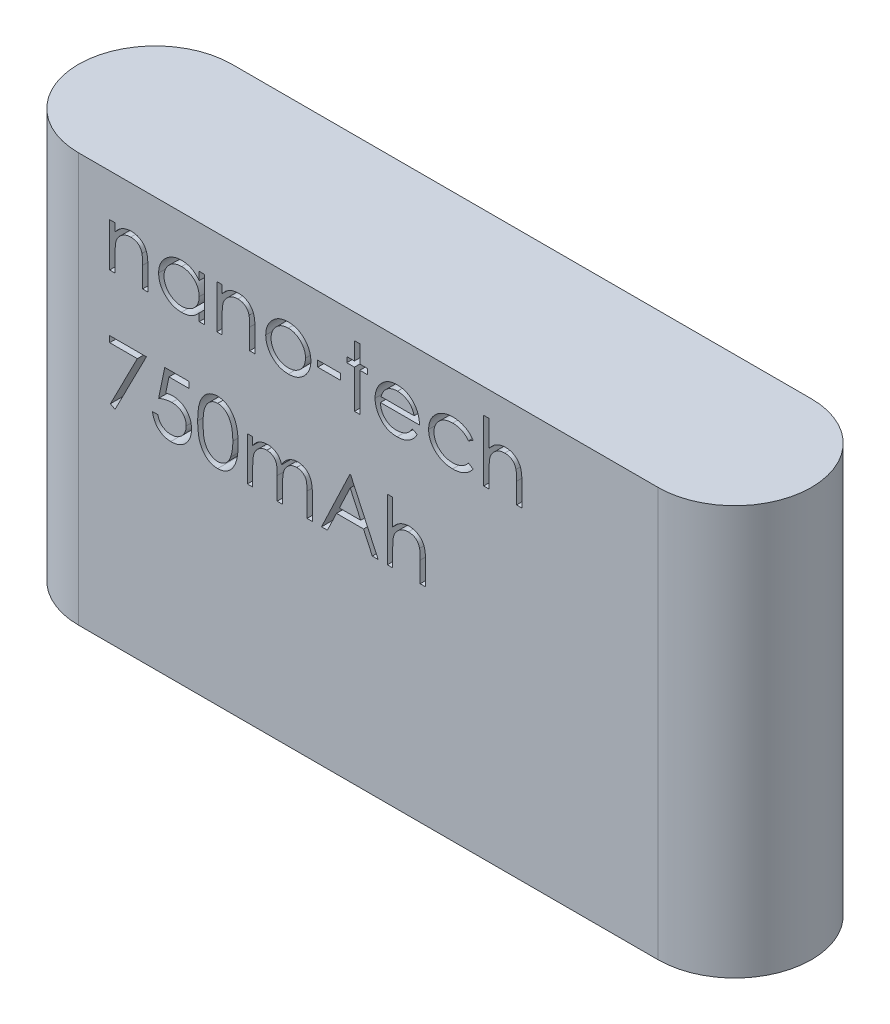
from build123d import *

# Parameters (mm, degrees)
SKICA1_W                 = 43
SKICA1_H                 = 24
P_IDAT_VYSUNUT_M1_DEPTH  = 9
ZAOBLIT1_RADIUS          = 4.5
ZAOBLIT1_LENGTH          = 24
ZAOBLIT2_RADIUS          = 4.5
ZAOBLIT2_LENGTH          = 24
SKICA2_W                 = 1.346153846
SKICA2_H                 = 0.358974359
ODEBRAT_VYSUNUT_M1_DEPTH = 6


with BuildPart() as part:
    # Skica1 → Přidat vysunutím1 (new body)
    with BuildSketch(Plane.XY):
        with Locations((-21.5, 12)):
            Rectangle(SKICA1_W, SKICA1_H)
    extrude(amount=P_IDAT_VYSUNUT_M1_DEPTH)

    # Zaoblit1: full round fillet: the end face becomes a half cylinder, R = half its width
    zaoblit1_face = Plane((-43, 12, 4.5), x_dir=(0, 1, 0), z_dir=(-1, 0, 0))  # on the end face: x along it, z out of the body
    zaoblit1_slab = zaoblit1_face.offset(-ZAOBLIT1_RADIUS / 2) * Box(ZAOBLIT1_LENGTH, 2 * ZAOBLIT1_RADIUS, ZAOBLIT1_RADIUS, mode=Mode.PRIVATE)  # the body's end, R deep
    zaoblit1_round = Plane((-38.5, 12, 4.5), x_dir=(-1, 0, 0), z_dir=(0, 1, 0)) * Cylinder(ZAOBLIT1_RADIUS, ZAOBLIT1_LENGTH, mode=Mode.PRIVATE)  # its axis R under the face
    add(zaoblit1_slab - zaoblit1_round, mode=Mode.SUBTRACT)

    # Zaoblit2: full round fillet: the end face becomes a half cylinder, R = half its width
    zaoblit2_face = Plane((0, 12, 4.5), x_dir=(0, -1, 0), z_dir=(1, 0, 0))  # on the end face: x along it, z out of the body
    zaoblit2_slab = zaoblit2_face.offset(-ZAOBLIT2_RADIUS / 2) * Box(ZAOBLIT2_LENGTH, 2 * ZAOBLIT2_RADIUS, ZAOBLIT2_RADIUS, mode=Mode.PRIVATE)  # the body's end, R deep
    zaoblit2_round = Plane((-4.5, 12, 4.5), x_dir=(1, 0, 0), z_dir=(0, -1, 0)) * Cylinder(ZAOBLIT2_RADIUS, ZAOBLIT2_LENGTH, mode=Mode.PRIVATE)  # its axis R under the face
    add(zaoblit2_slab - zaoblit2_round, mode=Mode.SUBTRACT)

    # Skica2 → Odebrat vysunutím1 (cut)
    # profile 1 of 15: a face of its own
    with BuildSketch(Plane.XY.offset(9)):
        with BuildLine():
            Line((-36.671617901, 21.517031429), (-36.357515337, 21.517031429))
            Line((-36.357515337, 21.517031429), (-36.357515337, 21.055693288))
            add(Edge.make_bspline(
                [(-36.357515337, 21.055693288), (-36.323977702, 21.097536011), (-36.258896751, 21.178733275), (-36.150512417, 21.285453849), (-36.035968517, 21.373399074), (-35.915966513, 21.443502868), (-35.790343503, 21.496349494), (-35.659865233, 21.534515425), (-35.523750527, 21.557400254), (-35.43118609, 21.560390484), (-35.384358285, 21.561903224)],
                knots=[0, 0, 0, 0, 1.12780773, 2.188550248, 3.19190651, 4.159438251, 5.104880172, 6.052711206, 7.014878035, 8, 8, 8, 8], degree=3))
            add(Edge.make_bspline(
                [(-35.384358285, 21.561903224), (-35.337027651, 21.560158029), (-35.244390184, 21.55674226), (-35.109512122, 21.529725569), (-34.983538728, 21.483580314), (-34.866919173, 21.420368244), (-34.761791959, 21.34176177), (-34.669467108, 21.250183989), (-34.59310386, 21.144847905), (-34.541906497, 21.047124749), (-34.50818085, 20.960435955), (-34.486948512, 20.886189205), (-34.468917531, 20.803471054), (-34.453285783, 20.712531465), (-34.442708671, 20.612733274), (-34.434366379, 20.504485582), (-34.428387685, 20.387823452), (-34.428150478, 20.307136824), (-34.428028157, 20.265529026)],
                knots=[0, 0, 0, 0, 1.235846778, 2.418850247, 3.575807741, 4.728682307, 5.871620074, 6.994088408, 8.11269785, 9.256955736, 9.865816715, 10.540099792, 11.271859618, 12.076849838, 12.949306005, 13.892391288, 14.913166135, 16, 16, 16, 16], degree=3))
            Line((-34.428028157, 20.265529026), (-34.428028157, 18.959339122))
            Line((-34.428028157, 18.959339122), (-34.742130721, 18.959339122))
            Line((-34.742130721, 18.959339122), (-34.742130721, 20.162464122))
            add(Edge.make_bspline(
                [(-34.742130721, 20.162464122), (-34.742323929, 20.197286567), (-34.742693503, 20.263895977), (-34.74385915, 20.359265001), (-34.746668957, 20.445751579), (-34.75061727, 20.523148946), (-34.7563963, 20.591382783), (-34.762418931, 20.65059206), (-34.769783908, 20.700701602), (-34.776346821, 20.730866685), (-34.779290176, 20.744395211)],
                knots=[0, 0, 0, 0, 1.430800155, 2.736877192, 3.918605307, 4.986035426, 5.920637409, 6.731861385, 7.431261377, 8, 8, 8, 8], degree=3))
            add(Edge.make_bspline(
                [(-34.779290176, 20.744395211), (-34.789915708, 20.784106396), (-34.810366569, 20.860538141), (-34.860900552, 20.964212494), (-34.924714733, 21.052410681), (-35.002612582, 21.124587403), (-35.093841658, 21.18075824), (-35.1981488, 21.219732195), (-35.314527441, 21.244108464), (-35.396381824, 21.246535596), (-35.439045785, 21.24780066)],
                knots=[0, 0, 0, 0, 1.084156227, 2.086665306, 3.027808233, 3.945421172, 4.874247719, 5.839848303, 6.874090471, 8, 8, 8, 8], degree=3))
            add(Edge.make_bspline(
                [(-35.439045785, 21.24780066), (-35.464313469, 21.247324656), (-35.514317562, 21.246382655), (-35.588467534, 21.236931357), (-35.660391707, 21.221472901), (-35.730811916, 21.200604263), (-35.79831971, 21.171941994), (-35.865084001, 21.139412624), (-35.928590765, 21.098864412), (-35.990194162, 21.053673791), (-36.04750697, 21.003594583), (-36.100835308, 20.950750073), (-36.148373329, 20.894474469), (-36.191442004, 20.835674522), (-36.228620267, 20.773542684), (-36.261073355, 20.708678377), (-36.28860905, 20.640996229), (-36.302291743, 20.594021167), (-36.309137933, 20.570517006)],
                knots=[0, 0, 0, 0, 1.023777757, 2.026029729, 3.023749952, 4.003683103, 4.997618607, 5.993177895, 7.010360494, 8.046726602, 9.087585522, 10.09234134, 11.086953743, 12.070360549, 13.043493632, 14.017870808, 15.008233677, 16, 16, 16, 16], degree=3))
            add(Edge.make_bspline(
                [(-36.309137933, 20.570517006), (-36.313077581, 20.553261803), (-36.32165399, 20.515698129), (-36.33091717, 20.454053709), (-36.339324746, 20.382743734), (-36.346361704, 20.301851417), (-36.350667121, 20.211093542), (-36.355361517, 20.110857705), (-36.357070578, 20.000744216), (-36.357362933, 19.924082523), (-36.357515337, 19.884118769)],
                knots=[0, 0, 0, 0, 0.615963638, 1.340920617, 2.168419149, 3.115676021, 4.16674242, 5.331190069, 6.6087489, 8, 8, 8, 8], degree=3))
            Line((-36.357515337, 19.884118769), (-36.357515337, 18.959339122))
            Line((-36.357515337, 18.959339122), (-36.671617901, 18.959339122))
            Line((-36.671617901, 18.959339122), (-36.671617901, 21.517031429))
        make_face()
    # profile 2 of 15: a face of its own
    with BuildSketch(Plane.XY.offset(9)):
        with BuildLine():
            Line((-31.107515337, 21.517031429), (-31.107515337, 18.959339122))
            Line((-31.107515337, 18.959339122), (-31.421617901, 18.959339122))
            Line((-31.421617901, 18.959339122), (-31.421617901, 19.401746974))
            add(Edge.make_bspline(
                [(-31.421617901, 19.401746974), (-31.457036691, 19.36170738), (-31.526156907, 19.283569609), (-31.641598025, 19.181487437), (-31.763966203, 19.097109115), (-31.892667524, 19.0289592), (-32.027585767, 18.977767143), (-32.168421854, 18.941380984), (-32.315233235, 18.917987149), (-32.41548559, 18.915651127), (-32.466289375, 18.914467327)],
                knots=[0, 0, 0, 0, 1.074387032, 2.096679803, 3.090159297, 4.057316773, 5.018401886, 5.985159533, 6.978961417, 8, 8, 8, 8], degree=3))
            add(Edge.make_bspline(
                [(-32.466289375, 18.914467327), (-32.511457329, 18.915693699), (-32.600530534, 18.91811216), (-32.731559611, 18.936874463), (-32.85765186, 18.967005085), (-32.978926433, 19.008905974), (-33.094598579, 19.064486796), (-33.205658675, 19.131028044), (-33.311531367, 19.210268874), (-33.410602906, 19.300856902), (-33.501834907, 19.39925189), (-33.581896179, 19.504197436), (-33.648649259, 19.61523974), (-33.70446934, 19.730972894), (-33.747465684, 19.852287814), (-33.777439318, 19.978764982), (-33.796179765, 20.110254855), (-33.798597226, 20.199794378), (-33.799823029, 20.245196494)],
                knots=[0, 0, 0, 0, 1.033919861, 2.038935746, 3.024066025, 3.998881131, 4.97069526, 5.957263378, 6.95902576, 7.993208707, 9.027059324, 10.027763471, 11.009749337, 11.988697705, 12.965288445, 13.950418724, 14.960734635, 16, 16, 16, 16], degree=3))
            add(Edge.make_bspline(
                [(-33.799823029, 20.245196494), (-33.798570058, 20.289660197), (-33.796093001, 20.37756254), (-33.777639781, 20.506841238), (-33.746608772, 20.631359499), (-33.703060925, 20.750716442), (-33.64721897, 20.865056492), (-33.579290883, 20.974460518), (-33.499271758, 21.079229915), (-33.407019351, 21.176901142), (-33.307084581, 21.267121756), (-33.20017585, 21.345530801), (-33.088952569, 21.41324765), (-32.971689558, 21.466901127), (-32.850122453, 21.510310231), (-32.723169007, 21.540343199), (-32.591357429, 21.558040521), (-32.501866937, 21.560603285), (-32.45647367, 21.561903224)],
                knots=[0, 0, 0, 0, 1.020392517, 2.01726096, 2.990465484, 3.961182959, 4.928053699, 5.906110375, 6.912531644, 7.948652711, 8.985773172, 9.998621852, 10.987621588, 11.969261332, 12.953316658, 13.946091881, 14.958173133, 16, 16, 16, 16], degree=3))
            add(Edge.make_bspline(
                [(-32.45647367, 21.561903224), (-32.404273811, 21.560465473), (-32.301912351, 21.55764611), (-32.152184342, 21.534183383), (-32.010539864, 21.494544915), (-31.875885512, 21.440627417), (-31.748704826, 21.368978688), (-31.630201841, 21.278598727), (-31.519136358, 21.17005754), (-31.454756066, 21.086687096), (-31.421617901, 21.043774218)],
                knots=[0, 0, 0, 0, 1.038897134, 2.037228247, 3.008116434, 3.962042015, 4.918381754, 5.904844433, 6.921570401, 8, 8, 8, 8], degree=3))
            Line((-31.421617901, 21.043774218), (-31.421617901, 21.517031429))
            Line((-31.421617901, 21.517031429), (-31.107515337, 21.517031429))
        make_face()
        with BuildLine():
            add(Edge.make_bspline(
                [(-32.452266939, 21.24780066), (-32.498181277, 21.246167022), (-32.588808877, 21.242942481), (-32.721852879, 21.217768986), (-32.849166293, 21.175884392), (-32.970112368, 21.118602491), (-33.082780584, 21.046573754), (-33.183474255, 20.959452371), (-33.273016956, 20.859615357), (-33.348325221, 20.747513246), (-33.409715717, 20.627335155), (-33.452882749, 20.501710717), (-33.481351997, 20.37290574), (-33.484260517, 20.285543054), (-33.485720465, 20.241690885)],
                knots=[0, 0, 0, 0, 1.031046209, 2.035121221, 3.029706178, 4.034933723, 5.034054252, 6.02443088, 7.017295772, 8.038157696, 9.050218397, 10.03989886, 11.016116709, 12, 12, 12, 12], degree=3))
            add(Edge.make_bspline(
                [(-33.485720465, 20.241690885), (-33.483855572, 20.198100777), (-33.480133095, 20.111091421), (-33.4533824, 19.982110845), (-33.408502527, 19.856456803), (-33.347260464, 19.735195809), (-33.270573839, 19.622611709), (-33.181685187, 19.520871586), (-33.079734906, 19.433381998), (-32.966807399, 19.360144424), (-32.846199428, 19.300981903), (-32.719365497, 19.259816264), (-32.588689858, 19.233238483), (-32.499837525, 19.230134006), (-32.455071426, 19.228569891)],
                knots=[0, 0, 0, 0, 0.979072187, 1.954306742, 2.945804271, 3.96968567, 4.997920485, 5.998718438, 6.996577872, 8.005894225, 9.015743152, 10.005417472, 10.995077863, 12, 12, 12, 12], degree=3))
            add(Edge.make_bspline(
                [(-32.455071426, 19.228569891), (-32.409624924, 19.230229855), (-32.319236337, 19.233531358), (-32.185797629, 19.258812624), (-32.056302666, 19.300581422), (-31.932515438, 19.358480549), (-31.817199307, 19.430237905), (-31.713701429, 19.514244996), (-31.626185461, 19.61194818), (-31.551992851, 19.719324633), (-31.493817435, 19.837036629), (-31.451441375, 19.96237082), (-31.42638747, 20.095331568), (-31.42322974, 20.186195495), (-31.421617901, 20.232576301)],
                knots=[0, 0, 0, 0, 1.01762866, 2.023962475, 3.030623092, 4.058876274, 5.077231937, 6.066672613, 7.034107872, 8.005628644, 8.981990164, 9.965428785, 10.961468474, 12, 12, 12, 12], degree=3))
            add(Edge.make_bspline(
                [(-31.421617901, 20.232576301), (-31.422577557, 20.267914132), (-31.424466465, 20.337470165), (-31.438897034, 20.439597683), (-31.461851961, 20.537331409), (-31.494198131, 20.630774098), (-31.536689415, 20.719409113), (-31.587937181, 20.803872873), (-31.648842631, 20.883726085), (-31.718425327, 20.957869156), (-31.794590529, 21.025495618), (-31.87518507, 21.085859859), (-31.961163817, 21.135448631), (-32.051080854, 21.176489903), (-32.145092188, 21.209149053), (-32.243962808, 21.230936747), (-32.346641795, 21.245897068), (-32.41668785, 21.247159448), (-32.452266939, 21.24780066)],
                knots=[0, 0, 0, 0, 1.050140795, 2.067009409, 3.05949893, 4.030605086, 5.00011959, 5.97591094, 6.962425594, 7.979863591, 8.993523472, 9.986985069, 10.967611495, 11.937549037, 12.921786183, 13.919465291, 14.943216303, 16, 16, 16, 16], degree=3))
        make_face(mode=Mode.SUBTRACT)
    # profile 3 of 15: a face of its own
    with BuildSketch(Plane.XY.offset(9)):
        with BuildLine():
            Line((-30.389566619, 21.517031429), (-30.075464055, 21.517031429))
            Line((-30.075464055, 21.517031429), (-30.075464055, 21.055693288))
            add(Edge.make_bspline(
                [(-30.075464055, 21.055693288), (-30.04192642, 21.097536011), (-29.976845468, 21.178733275), (-29.868461135, 21.285453849), (-29.753917235, 21.373399074), (-29.633915231, 21.443502868), (-29.508292221, 21.496349494), (-29.377813951, 21.534515425), (-29.241699245, 21.557400254), (-29.149134808, 21.560390484), (-29.102307003, 21.561903224)],
                knots=[0, 0, 0, 0, 1.12780773, 2.188550248, 3.19190651, 4.159438251, 5.104880172, 6.052711206, 7.014878035, 8, 8, 8, 8], degree=3))
            add(Edge.make_bspline(
                [(-29.102307003, 21.561903224), (-29.054976369, 21.560158029), (-28.962338901, 21.55674226), (-28.82746084, 21.529725569), (-28.701487446, 21.483580314), (-28.584867891, 21.420368244), (-28.479740677, 21.34176177), (-28.387415826, 21.250183989), (-28.311052578, 21.144847905), (-28.259855215, 21.047124749), (-28.226129568, 20.960435955), (-28.20489723, 20.886189205), (-28.186866249, 20.803471054), (-28.171234501, 20.712531465), (-28.160657389, 20.612733274), (-28.152315097, 20.504485582), (-28.146336403, 20.387823452), (-28.146099196, 20.307136824), (-28.145976875, 20.265529026)],
                knots=[0, 0, 0, 0, 1.235846778, 2.418850247, 3.575807741, 4.728682307, 5.871620074, 6.994088408, 8.11269785, 9.256955736, 9.865816715, 10.540099792, 11.271859618, 12.076849838, 12.949306005, 13.892391288, 14.913166135, 16, 16, 16, 16], degree=3))
            Line((-28.145976875, 20.265529026), (-28.145976875, 18.959339122))
            Line((-28.145976875, 18.959339122), (-28.460079439, 18.959339122))
            Line((-28.460079439, 18.959339122), (-28.460079439, 20.162464122))
            add(Edge.make_bspline(
                [(-28.460079439, 20.162464122), (-28.460272647, 20.197286567), (-28.460642221, 20.263895977), (-28.461807868, 20.359265001), (-28.464617675, 20.445751579), (-28.468565988, 20.523148946), (-28.474345018, 20.591382783), (-28.480367649, 20.65059206), (-28.487732626, 20.700701602), (-28.494295539, 20.730866685), (-28.497238894, 20.744395211)],
                knots=[0, 0, 0, 0, 1.430800155, 2.736877192, 3.918605307, 4.986035426, 5.920637409, 6.731861385, 7.431261377, 8, 8, 8, 8], degree=3))
            add(Edge.make_bspline(
                [(-28.497238894, 20.744395211), (-28.507864426, 20.784106396), (-28.528315287, 20.860538141), (-28.57884927, 20.964212494), (-28.64266345, 21.052410681), (-28.7205613, 21.124587403), (-28.811790375, 21.18075824), (-28.916097518, 21.219732195), (-29.032476159, 21.244108464), (-29.114330542, 21.246535596), (-29.156994503, 21.24780066)],
                knots=[0, 0, 0, 0, 1.084156227, 2.086665306, 3.027808233, 3.945421172, 4.874247719, 5.839848303, 6.874090471, 8, 8, 8, 8], degree=3))
            add(Edge.make_bspline(
                [(-29.156994503, 21.24780066), (-29.182262187, 21.247324656), (-29.23226628, 21.246382655), (-29.306416252, 21.236931357), (-29.378340425, 21.221472901), (-29.448760634, 21.200604263), (-29.516268428, 21.171941994), (-29.583032719, 21.139412624), (-29.646539483, 21.098864412), (-29.70814288, 21.053673791), (-29.765455688, 21.003594583), (-29.818784026, 20.950750073), (-29.866322047, 20.894474469), (-29.909390722, 20.835674522), (-29.946568985, 20.773542684), (-29.979022073, 20.708678377), (-30.006557768, 20.640996229), (-30.020240461, 20.594021167), (-30.027086651, 20.570517006)],
                knots=[0, 0, 0, 0, 1.023777757, 2.026029729, 3.023749952, 4.003683103, 4.997618607, 5.993177895, 7.010360494, 8.046726602, 9.087585522, 10.09234134, 11.086953743, 12.070360549, 13.043493632, 14.017870808, 15.008233677, 16, 16, 16, 16], degree=3))
            add(Edge.make_bspline(
                [(-30.027086651, 20.570517006), (-30.031026299, 20.553261803), (-30.039602708, 20.515698129), (-30.048865888, 20.454053709), (-30.057273464, 20.382743734), (-30.064310422, 20.301851417), (-30.068615839, 20.211093542), (-30.073310235, 20.110857705), (-30.075019296, 20.000744216), (-30.07531165, 19.924082523), (-30.075464055, 19.884118769)],
                knots=[0, 0, 0, 0, 0.615963638, 1.340920617, 2.168419149, 3.115676021, 4.16674242, 5.331190069, 6.6087489, 8, 8, 8, 8], degree=3))
            Line((-30.075464055, 19.884118769), (-30.075464055, 18.959339122))
            Line((-30.075464055, 18.959339122), (-30.389566619, 18.959339122))
            Line((-30.389566619, 18.959339122), (-30.389566619, 21.517031429))
        make_face()
    # profile 4 of 15: a face of its own
    with BuildSketch(Plane.XY.offset(9)):
        with BuildLine():
            add(Edge.make_bspline(
                [(-26.192651555, 21.561903224), (-26.144660282, 21.560881333), (-26.050561124, 21.558877654), (-25.912753238, 21.537462689), (-25.781208102, 21.504715324), (-25.65542191, 21.459443762), (-25.537005615, 21.398761812), (-25.424234371, 21.326352521), (-25.317417362, 21.240569927), (-25.253394333, 21.174211859), (-25.220896747, 21.140529026)],
                knots=[0, 0, 0, 0, 1.054011418, 2.066658804, 3.057071809, 4.030435133, 4.997543892, 5.974964718, 6.972108034, 8, 8, 8, 8], degree=3))
            add(Edge.make_bspline(
                [(-25.220896747, 21.140529026), (-25.192914793, 21.10831504), (-25.137492413, 21.044510498), (-25.066426694, 20.941054885), (-25.005205134, 20.833914784), (-24.956142173, 20.721667457), (-24.917457149, 20.605292786), (-24.889991453, 20.484390775), (-24.873654518, 20.359228428), (-24.871451551, 20.27422459), (-24.87033585, 20.231174058)],
                knots=[0, 0, 0, 0, 1.025258237, 2.030674902, 3.01204498, 3.988269485, 4.97094183, 5.956517959, 6.965070386, 8, 8, 8, 8], degree=3))
            add(Edge.make_bspline(
                [(-24.87033585, 20.231174058), (-24.871317187, 20.187874), (-24.873256355, 20.102311067), (-24.891599972, 19.976291701), (-24.920131057, 19.854096878), (-24.960962896, 19.736238184), (-25.013321005, 19.622355357), (-25.077211692, 19.512945808), (-25.15308331, 19.407793674), (-25.239087306, 19.307791836), (-25.334139182, 19.215625621), (-25.437255331, 19.135297352), (-25.546409365, 19.066475827), (-25.663052718, 19.011039412), (-25.786120205, 18.967329712), (-25.915877273, 18.936629695), (-26.052122343, 18.918068011), (-26.145149564, 18.915684438), (-26.192651555, 18.914467327)],
                knots=[0, 0, 0, 0, 0.998656419, 1.973391657, 2.932242238, 3.890759089, 4.846373663, 5.82037756, 6.809684879, 7.83454468, 8.860553229, 9.859544525, 10.845671541, 11.83227036, 12.833544569, 13.85385346, 14.904124723, 16, 16, 16, 16], degree=3))
            add(Edge.make_bspline(
                [(-26.192651555, 18.914467327), (-26.240386274, 18.915688523), (-26.333877134, 18.918080298), (-26.470603116, 18.93655758), (-26.600592735, 18.967315563), (-26.723821333, 19.011183056), (-26.84096618, 19.066477599), (-26.950752677, 19.135089289), (-27.053952593, 19.215649444), (-27.149024577, 19.307785381), (-27.235023182, 19.407795338), (-27.310896191, 19.512945376), (-27.374786517, 19.622355469), (-27.427144721, 19.736238154), (-27.467976534, 19.854096886), (-27.496507626, 19.976291699), (-27.514851241, 20.102311067), (-27.51679041, 20.187874), (-27.517771747, 20.231174058)],
                knots=[0, 0, 0, 0, 1.099876186, 2.154163076, 3.173186993, 4.173200201, 5.163417411, 6.152872554, 7.150605724, 8.17532212, 9.198891216, 10.186952605, 11.159729845, 12.11414092, 13.071450619, 14.029093627, 15.002601286, 16, 16, 16, 16], degree=3))
            add(Edge.make_bspline(
                [(-27.517771747, 20.231174058), (-27.516648437, 20.273990604), (-27.514424475, 20.358760006), (-27.498103966, 20.483687067), (-27.47074541, 20.604384456), (-27.432014013, 20.720309932), (-27.382498822, 20.832065368), (-27.322137534, 20.939470199), (-27.250346902, 21.042457999), (-27.19514495, 21.106180079), (-27.16721085, 21.13842566)],
                knots=[0, 0, 0, 0, 1.031353054, 2.041901799, 3.029428768, 4.008703097, 4.981709435, 5.96992636, 6.972712378, 8, 8, 8, 8], degree=3))
            add(Edge.make_bspline(
                [(-27.16721085, 21.13842566), (-27.134762258, 21.172400599), (-27.070946395, 21.239218296), (-26.963597667, 21.32475082), (-26.851103846, 21.398666894), (-26.73137892, 21.458143109), (-26.605696062, 21.504981627), (-26.473476819, 21.537547142), (-26.335201304, 21.558800497), (-26.240641683, 21.560858675), (-26.192651555, 21.561903224)],
                knots=[0, 0, 0, 0, 1.027980169, 2.021703884, 2.998553061, 3.971491411, 4.943284454, 5.930300938, 6.949603206, 8, 8, 8, 8], degree=3))
        make_face()
        with BuildLine():
            add(Edge.make_bspline(
                [(-26.194053798, 21.24780066), (-26.22799141, 21.246836069), (-26.294990538, 21.244931786), (-26.393610123, 21.230447881), (-26.488550277, 21.207500377), (-26.579991121, 21.174896321), (-26.667624293, 21.132797422), (-26.751533696, 21.081089062), (-26.831966136, 21.020456105), (-26.907348199, 20.950993434), (-26.976530511, 20.875114439), (-27.037008488, 20.79426608), (-27.088433594, 20.709759734), (-27.131273753, 20.621507523), (-27.163180941, 20.528615109), (-27.186353964, 20.432134478), (-27.200824204, 20.331869061), (-27.202710583, 20.263708043), (-27.203669183, 20.229070692)],
                knots=[0, 0, 0, 0, 1.021534396, 2.016698045, 2.994645724, 3.958388632, 4.93408049, 5.916473867, 6.921342795, 7.962252576, 8.998418191, 10.008913653, 10.997312074, 11.973003931, 12.956656626, 13.948281152, 14.957379055, 16, 16, 16, 16], degree=3))
            add(Edge.make_bspline(
                [(-27.203669183, 20.229070692), (-27.202062359, 20.184318665), (-27.198873115, 20.09549426), (-27.172937878, 19.964683137), (-27.129551598, 19.839101285), (-27.070964319, 19.719484899), (-26.9975581, 19.608812621), (-26.911071033, 19.510141136), (-26.812431333, 19.424955325), (-26.702814833, 19.354274479), (-26.584460515, 19.298114724), (-26.459204194, 19.258315748), (-26.3285635, 19.232444056), (-26.239282769, 19.229872581), (-26.194053798, 19.228569891)],
                knots=[0, 0, 0, 0, 1.016792936, 2.018143844, 3.017858371, 4.030088057, 5.03801393, 6.028138512, 7.003788237, 7.991172063, 8.984598303, 9.972568034, 10.972917682, 12, 12, 12, 12], degree=3))
            add(Edge.make_bspline(
                [(-26.194053798, 19.228569891), (-26.148827429, 19.229880171), (-26.059551833, 19.232466628), (-25.929092657, 19.258185448), (-25.804178685, 19.298289108), (-25.685947297, 19.354211318), (-25.576380694, 19.425223733), (-25.477031572, 19.50966011), (-25.391282961, 19.609073962), (-25.317949356, 19.71963149), (-25.258402614, 19.838915842), (-25.215219412, 19.964706315), (-25.189221826, 20.095488357), (-25.186040997, 20.184316687), (-25.184438414, 20.229070692)],
                knots=[0, 0, 0, 0, 1.02726834, 2.027799167, 3.010890988, 4.004497153, 4.992059811, 5.971914811, 6.958719428, 7.966827853, 8.981595046, 9.981490638, 10.983022906, 12, 12, 12, 12], degree=3))
            add(Edge.make_bspline(
                [(-25.184438414, 20.229070692), (-25.185396684, 20.26370825), (-25.187282413, 20.331869676), (-25.201757377, 20.432132129), (-25.224912917, 20.528623726), (-25.256884534, 20.621475729), (-25.299538548, 20.709988233), (-25.351955341, 20.79401796), (-25.412186366, 20.875394507), (-25.482203487, 20.950748147), (-25.557506865, 21.020483184), (-25.637971903, 21.081112573), (-25.721756882, 21.132570169), (-25.809135465, 21.175256409), (-25.900588032, 21.20720375), (-25.995395161, 21.230580381), (-26.093593971, 21.244870578), (-26.160353015, 21.246817719), (-26.194053798, 21.24780066)],
                knots=[0, 0, 0, 0, 1.042956736, 2.052379634, 3.044323526, 4.02829302, 5.004299113, 5.996692471, 7.007513377, 8.048758398, 9.090003419, 10.095195979, 11.07790575, 12.047570684, 13.018257071, 13.989683339, 14.985167495, 16, 16, 16, 16], degree=3))
        make_face(mode=Mode.SUBTRACT)
    # profile 5 of 15: a face of its own
    with BuildSketch(Plane.XY.offset(9)):
        with Locations((-23.793412773, 20.305492968)):
            Rectangle(SKICA2_W, SKICA2_H)
    # profile 6 of 15: a face of its own
    with BuildSketch(Plane.XY.offset(9)):
        Polygon((-22.312643542, 22.549082711), (-21.998540978, 22.549082711), (-21.998540978, 21.517031429), (-21.549823029, 21.517031429), (-21.549823029, 21.202928865), (-21.998540978, 21.202928865), (-21.998540978, 18.959339122), (-22.312643542, 18.959339122), (-22.312643542, 21.202928865), (-22.761361491, 21.202928865), (-22.761361491, 21.517031429), (-22.312643542, 21.517031429), align=None)
    # profile 7 of 15: a face of its own
    with BuildSketch(Plane.XY.offset(9)):
        with BuildLine():
            Line((-18.912202837, 19.767031429), (-18.633156362, 19.620496974))
            add(Edge.make_bspline(
                [(-18.633156362, 19.620496974), (-18.655392958, 19.581053643), (-18.698656566, 19.50431254), (-18.773057314, 19.39888068), (-18.851049387, 19.304032964), (-18.936153355, 19.22230331), (-19.025823033, 19.151051925), (-19.120555688, 19.0887141), (-19.220844506, 19.03559558), (-19.326694231, 18.990843052), (-19.438993782, 18.956433558), (-19.558015298, 18.932129337), (-19.683986794, 18.917106068), (-19.770332974, 18.915360927), (-19.814546587, 18.914467327)],
                knots=[0, 0, 0, 0, 1.120438281, 2.179929193, 3.190490725, 4.156257408, 5.095198341, 6.022838206, 6.959905092, 7.901321166, 8.864066838, 9.862729781, 10.905609505, 12, 12, 12, 12], degree=3))
            add(Edge.make_bspline(
                [(-19.814546587, 18.914467327), (-19.863688564, 18.915614502), (-19.959550326, 18.917852309), (-20.099090073, 18.937144773), (-20.230469491, 18.968617132), (-20.353681195, 19.012582674), (-20.468423447, 19.070009998), (-20.574924302, 19.139969479), (-20.673743828, 19.222101734), (-20.761768037, 19.317118178), (-20.84101192, 19.418800135), (-20.91093774, 19.524756019), (-20.969395171, 19.634719244), (-21.016947781, 19.747989768), (-21.055352646, 19.863853661), (-21.08211935, 19.983365129), (-21.097549098, 20.106200713), (-21.099913543, 20.189298049), (-21.10110508, 20.231174058)],
                knots=[0, 0, 0, 0, 1.145258523, 2.234067595, 3.276747158, 4.290159414, 5.277019952, 6.260822364, 7.254936242, 8.264827045, 9.274100331, 10.257902744, 11.220704747, 12.172965371, 13.118907548, 14.062713208, 15.023725156, 16, 16, 16, 16], degree=3))
            add(Edge.make_bspline(
                [(-21.10110508, 20.231174058), (-21.100045939, 20.270468888), (-21.097946861, 20.348346053), (-21.084716073, 20.463611597), (-21.06126778, 20.57564005), (-21.029091456, 20.684524498), (-20.98754021, 20.790082632), (-20.936707991, 20.892378695), (-20.876515613, 20.991303835), (-20.830042939, 21.053706969), (-20.806633926, 21.085140404)],
                knots=[0, 0, 0, 0, 1.024358464, 2.0301432, 3.019427413, 4.004406732, 4.986367066, 5.972626655, 6.978780325, 8, 8, 8, 8], degree=3))
            add(Edge.make_bspline(
                [(-20.806633926, 21.085140404), (-20.774926244, 21.123009274), (-20.712515297, 21.197547424), (-20.606958942, 21.29548575), (-20.492658745, 21.377529525), (-20.371047119, 21.445536661), (-20.240710645, 21.497210308), (-20.103401354, 21.535717891), (-19.957555768, 21.557295902), (-19.857850547, 21.560343735), (-19.806834247, 21.561903224)],
                knots=[0, 0, 0, 0, 1.030682036, 2.02871468, 2.997146059, 3.962720338, 4.930598197, 5.918074684, 6.934738563, 8, 8, 8, 8], degree=3))
            add(Edge.make_bspline(
                [(-19.806834247, 21.561903224), (-19.754386642, 21.560549175), (-19.651496396, 21.55789284), (-19.501464275, 21.533266507), (-19.359503558, 21.494213952), (-19.225671054, 21.439060162), (-19.099953193, 21.36790061), (-18.983167144, 21.279758768), (-18.873315631, 21.177340681), (-18.809407052, 21.098577472), (-18.77688633, 21.058497776)],
                knots=[0, 0, 0, 0, 1.056321875, 2.072262726, 3.055038591, 4.01806755, 4.982017516, 5.957941055, 6.960871419, 8, 8, 8, 8], degree=3))
            add(Edge.make_bspline(
                [(-18.77688633, 21.058497776), (-18.754759392, 21.028294194), (-18.710652799, 20.968088075), (-18.655405699, 20.869916918), (-18.607448304, 20.767206324), (-18.569115343, 20.658296027), (-18.538075842, 20.544476447), (-18.515619023, 20.424933902), (-18.502449404, 20.299703991), (-18.499860707, 20.214377435), (-18.498540978, 20.170877583)],
                knots=[0, 0, 0, 0, 0.94817472, 1.890038105, 2.849395472, 3.817997239, 4.812318967, 5.836947057, 6.897266129, 8, 8, 8, 8], degree=3))
            Line((-18.498540978, 20.170877583), (-20.787002516, 20.170877583))
            add(Edge.make_bspline(
                [(-20.787002516, 20.170877583), (-20.78546291, 20.137177119), (-20.782435336, 20.070906515), (-20.768320193, 19.973935732), (-20.746071419, 19.88156239), (-20.714802356, 19.794479348), (-20.676935511, 19.711549221), (-20.630549794, 19.633387184), (-20.57521024, 19.560349254), (-20.513484541, 19.491782116), (-20.444777446, 19.430721355), (-20.372494698, 19.376069579), (-20.295601133, 19.330263982), (-20.21470305, 19.293084092), (-20.129931265, 19.263977776), (-20.04125907, 19.244109955), (-19.948860953, 19.230802848), (-19.885875219, 19.229323183), (-19.853809407, 19.228569891)],
                knots=[0, 0, 0, 0, 1.094153842, 2.151609401, 3.174256925, 4.172055639, 5.149267565, 6.128595816, 7.11444997, 8.118368179, 9.117203808, 10.09244225, 11.054858984, 12.015122123, 12.976791628, 13.957293641, 14.960065497, 16, 16, 16, 16], degree=3))
            add(Edge.make_bspline(
                [(-19.853809407, 19.228569891), (-19.82245826, 19.229177948), (-19.760251569, 19.230384449), (-19.667610711, 19.24211636), (-19.576471184, 19.261086635), (-19.487210201, 19.286976625), (-19.401639355, 19.318553477), (-19.322393805, 19.356656335), (-19.249513589, 19.398806082), (-19.181396622, 19.447015757), (-19.115325629, 19.506023944), (-19.049783143, 19.579659665), (-18.979506489, 19.666747193), (-18.935516897, 19.732292859), (-18.912202837, 19.767031429)],
                knots=[0, 0, 0, 0, 0.99110716, 1.966546729, 2.947904876, 3.932708344, 4.903319531, 5.828989031, 6.710028674, 7.56322171, 8.463672341, 9.504779593, 10.677557249, 12, 12, 12, 12], degree=3))
        make_face()
        with BuildLine():
            add(Edge.make_bspline(
                [(-18.812643542, 20.484980147), (-18.824140166, 20.526643021), (-18.846267468, 20.606830642), (-18.892503832, 20.717871532), (-18.944575373, 20.816559433), (-19.006197104, 20.902139066), (-19.07601583, 20.978142579), (-19.156661013, 21.044561164), (-19.247096906, 21.103978615), (-19.346856047, 21.154131115), (-19.452497832, 21.196820974), (-19.563104024, 21.225446089), (-19.675961812, 21.245055632), (-19.752296098, 21.24688174), (-19.790708446, 21.24780066)],
                knots=[0, 0, 0, 0, 1.154881502, 2.222775134, 3.210006277, 4.132804581, 5.035138423, 5.962687519, 6.919655026, 7.923214229, 8.944639381, 9.960483929, 10.97369054, 12, 12, 12, 12], degree=3))
            add(Edge.make_bspline(
                [(-19.790708446, 21.24780066), (-19.822057884, 21.247188989), (-19.884029133, 21.245979843), (-19.975330201, 21.234509713), (-20.0630099, 21.215549868), (-20.147715188, 21.189584912), (-20.228336056, 21.154976309), (-20.306530825, 21.114393083), (-20.380311221, 21.064851499), (-20.426452516, 21.027092644), (-20.449762933, 21.008017006)],
                knots=[0, 0, 0, 0, 1.04873581, 2.073130211, 3.073294108, 4.04793562, 5.032784715, 6.005352987, 6.992311501, 8, 8, 8, 8], degree=3))
            add(Edge.make_bspline(
                [(-20.449762933, 21.008017006), (-20.466456215, 20.992922691), (-20.500239349, 20.962375475), (-20.545379871, 20.909746268), (-20.588600343, 20.852994706), (-20.627933996, 20.789949581), (-20.664011582, 20.721328802), (-20.69777156, 20.647711167), (-20.728157972, 20.568538037), (-20.745254082, 20.513365598), (-20.754049792, 20.484980147)],
                knots=[0, 0, 0, 0, 0.879870761, 1.780643979, 2.707998968, 3.669668524, 4.684282772, 5.740141944, 6.837334558, 8, 8, 8, 8], degree=3))
            Line((-20.754049792, 20.484980147), (-18.812643542, 20.484980147))
        make_face(mode=Mode.SUBTRACT)
    # profile 8 of 15: a face of its own
    with BuildSketch(Plane.XY.offset(9)):
        with BuildLine():
            Line((-15.357515337, 20.96244409), (-15.62043601, 20.799082711))
            add(Edge.make_bspline(
                [(-15.62043601, 20.799082711), (-15.649265875, 20.834911105), (-15.70601257, 20.905433216), (-15.804551807, 20.996443149), (-15.909563221, 21.074610191), (-16.022841269, 21.138313942), (-16.144227069, 21.187535392), (-16.27324192, 21.222365597), (-16.409867425, 21.24406984), (-16.503532624, 21.246536677), (-16.551525753, 21.24780066)],
                knots=[0, 0, 0, 0, 1.026593902, 2.0206758, 2.988051866, 3.946915611, 4.916868779, 5.907761954, 6.927957743, 8, 8, 8, 8], degree=3))
            add(Edge.make_bspline(
                [(-16.551525753, 21.24780066), (-16.58988471, 21.246743818), (-16.665431633, 21.244662396), (-16.776337786, 21.231651903), (-16.881980139, 21.208009894), (-16.983020848, 21.176858938), (-17.078741267, 21.135108648), (-17.169392185, 21.084298892), (-17.255777675, 21.025248851), (-17.335394417, 20.956838306), (-17.408223424, 20.882439638), (-17.471322338, 20.802685943), (-17.526259271, 20.719966052), (-17.569365227, 20.632214309), (-17.604640398, 20.541438256), (-17.627847118, 20.4459244), (-17.643311813, 20.346896393), (-17.645081142, 20.279378053), (-17.645976875, 20.245196494)],
                knots=[0, 0, 0, 0, 1.112346261, 2.190735716, 3.231507886, 4.247384806, 5.251966152, 6.253067467, 7.256802811, 8.280671706, 9.291813951, 10.270744147, 11.225547591, 12.165006084, 13.100104208, 14.043489273, 15.009504848, 16, 16, 16, 16], degree=3))
            add(Edge.make_bspline(
                [(-17.645976875, 20.245196494), (-17.644197623, 20.200427282), (-17.640663092, 20.111492087), (-17.612961633, 19.980213985), (-17.567617225, 19.853290295), (-17.505559375, 19.731622157), (-17.42708224, 19.619028002), (-17.334909677, 19.518044548), (-17.228990594, 19.43062852), (-17.110258263, 19.358155994), (-16.98150052, 19.299894627), (-16.844110415, 19.258387294), (-16.699210634, 19.233334921), (-16.600003887, 19.230178978), (-16.549422388, 19.228569891)],
                knots=[0, 0, 0, 0, 0.966302908, 1.919585723, 2.883856336, 3.870342332, 4.860282998, 5.839159637, 6.814385684, 7.815993281, 8.834850808, 9.858348828, 10.908058873, 12, 12, 12, 12], degree=3))
            add(Edge.make_bspline(
                [(-16.549422388, 19.228569891), (-16.503067204, 19.229869388), (-16.411966965, 19.232423245), (-16.27879968, 19.253952208), (-16.152019769, 19.289195842), (-16.031631739, 19.338343492), (-15.917855573, 19.401871008), (-15.811426398, 19.480230179), (-15.710226459, 19.571166779), (-15.650729483, 19.64148475), (-15.62043601, 19.67728784)],
                knots=[0, 0, 0, 0, 1.039848629, 2.043578496, 3.018386758, 3.987534228, 4.954977003, 5.934852016, 6.948509513, 8, 8, 8, 8], degree=3))
            Line((-15.62043601, 19.67728784), (-15.357515337, 19.504811878))
            add(Edge.make_bspline(
                [(-15.357515337, 19.504811878), (-15.373103039, 19.481921151), (-15.404226706, 19.436215675), (-15.456254331, 19.371771558), (-15.512374163, 19.311449876), (-15.57236726, 19.255331485), (-15.63545027, 19.202073466), (-15.703778179, 19.154221892), (-15.775147791, 19.109087069), (-15.850396948, 19.068474197), (-15.928747646, 19.031967875), (-16.010089636, 19.000576705), (-16.094069449, 18.973606599), (-16.180785825, 18.952169252), (-16.270409723, 18.935058413), (-16.362709358, 18.923704712), (-16.457652939, 18.915229431), (-16.521825091, 18.914723564), (-16.554330241, 18.914467327)],
                knots=[0, 0, 0, 0, 0.954134338, 1.905101784, 2.851144739, 3.791306361, 4.734911809, 5.6936923, 6.663572882, 7.643865596, 8.638447847, 9.640600242, 10.646758161, 11.676244097, 12.717260333, 13.78922464, 14.880174919, 16, 16, 16, 16], degree=3))
            add(Edge.make_bspline(
                [(-16.554330241, 18.914467327), (-16.603941124, 18.915358607), (-16.701178816, 18.917105522), (-16.843501324, 18.936313997), (-16.979514991, 18.965271613), (-17.109173349, 19.006835347), (-17.232496583, 19.060340122), (-17.349369702, 19.125697037), (-17.45940572, 19.203448827), (-17.561516503, 19.292211596), (-17.655297949, 19.388452237), (-17.735824139, 19.492302155), (-17.80566941, 19.599943203), (-17.861756953, 19.713752729), (-17.906403879, 19.832218102), (-17.936908712, 19.956288342), (-17.956638449, 20.084940596), (-17.958921829, 20.172673478), (-17.960079439, 20.217151622)],
                knots=[0, 0, 0, 0, 1.1129367, 2.181364009, 3.217532258, 4.231199276, 5.232079859, 6.230262199, 7.231623845, 8.250719726, 9.263571943, 10.242672461, 11.195837495, 12.138959767, 13.085126421, 14.0317438, 15.002148558, 16, 16, 16, 16], degree=3))
            add(Edge.make_bspline(
                [(-17.960079439, 20.217151622), (-17.959638423, 20.247330056), (-17.958761169, 20.307359944), (-17.948699242, 20.39645501), (-17.935700769, 20.484363556), (-17.913675032, 20.569971275), (-17.8882344, 20.654576565), (-17.855758868, 20.737159666), (-17.817663473, 20.818104339), (-17.774411526, 20.897202069), (-17.725722781, 20.973151608), (-17.671841547, 21.044905273), (-17.614797211, 21.113325038), (-17.551921099, 21.176048799), (-17.485881445, 21.23558499), (-17.41480987, 21.290343115), (-17.339114018, 21.340484106), (-17.259930695, 21.386935121), (-17.177305984, 21.428294556), (-17.091739314, 21.463927794), (-17.003746285, 21.49438037), (-16.91318614, 21.518489289), (-16.820659967, 21.538706713), (-16.725438629, 21.551424559), (-16.627886407, 21.560410832), (-16.561830384, 21.561401624), (-16.528388734, 21.561903224)],
                knots=[0, 0, 0, 0, 0.990994727, 1.971252077, 2.943264845, 3.907940874, 4.872158414, 5.844625996, 6.82015047, 7.809835459, 8.804511986, 9.781214284, 10.756496977, 11.728388426, 12.696359165, 13.676225489, 14.672885716, 15.677705647, 16.690706858, 17.706033469, 18.721040654, 19.747369689, 20.783475414, 21.830280724, 22.901553713, 24, 24, 24, 24], degree=3))
            add(Edge.make_bspline(
                [(-16.528388734, 21.561903224), (-16.486508626, 21.560981333), (-16.402957746, 21.559142159), (-16.27901704, 21.543663507), (-16.156901846, 21.52032709), (-16.038754742, 21.485754261), (-15.926008228, 21.443890605), (-15.820472778, 21.396877891), (-15.724632674, 21.342283287), (-15.636705085, 21.282563173), (-15.556525567, 21.215202267), (-15.483271075, 21.13939531), (-15.415439426, 21.055536831), (-15.376982714, 20.993731099), (-15.357515337, 20.96244409)],
                knots=[0, 0, 0, 0, 1.095225653, 2.184976855, 3.262915854, 4.344593502, 5.400796181, 6.407717688, 7.363229445, 8.282371371, 9.184954523, 10.097238608, 11.036792983, 12, 12, 12, 12], degree=3))
        make_face()
    # profile 9 of 15: a face of its own
    with BuildSketch(Plane.XY.offset(9)):
        with BuildLine():
            Line((-14.729310209, 22.549082711), (-14.415207644, 22.549082711))
            Line((-14.415207644, 22.549082711), (-14.415207644, 21.033958513))
            add(Edge.make_bspline(
                [(-14.415207644, 21.033958513), (-14.381490343, 21.076102495), (-14.315841029, 21.158158988), (-14.205344912, 21.265220178), (-14.09187404, 21.3580188), (-13.97150923, 21.431889257), (-13.84645871, 21.4902458), (-13.716195065, 21.531633447), (-13.580694094, 21.557084543), (-13.488668944, 21.560282961), (-13.442050593, 21.561903224)],
                knots=[0, 0, 0, 0, 1.125788106, 2.19196713, 3.20547328, 4.180437432, 5.132270164, 6.079753143, 7.027236121, 8, 8, 8, 8], degree=3))
            add(Edge.make_bspline(
                [(-13.442050593, 21.561903224), (-13.3947202, 21.560157794), (-13.302083205, 21.556741566), (-13.167201742, 21.529728185), (-13.041240867, 21.483570747), (-12.924575024, 21.420403722), (-12.819750327, 21.341730895), (-12.726900563, 21.250899372), (-12.651059764, 21.145625454), (-12.599460647, 21.0483692), (-12.565887239, 20.961830446), (-12.544635413, 20.887593934), (-12.526616215, 20.80487202), (-12.510916479, 20.713707288), (-12.500452897, 20.613662117), (-12.492048279, 20.505187862), (-12.486071825, 20.388290744), (-12.485840221, 20.307370495), (-12.485720465, 20.265529026)],
                knots=[0, 0, 0, 0, 1.235656852, 2.418478516, 3.575258207, 4.727955599, 5.870717718, 6.98870536, 8.107142894, 9.245821548, 9.854588956, 10.528768408, 11.260415777, 12.065282286, 12.943670737, 13.886611085, 14.907229059, 16, 16, 16, 16], degree=3))
            Line((-12.485720465, 20.265529026), (-12.485720465, 18.959339122))
            Line((-12.485720465, 18.959339122), (-12.799823029, 18.959339122))
            Line((-12.799823029, 18.959339122), (-12.799823029, 20.162464122))
            add(Edge.make_bspline(
                [(-12.799823029, 20.162464122), (-12.800013332, 20.197286791), (-12.80037735, 20.263896632), (-12.801580694, 20.35926274), (-12.80426691, 20.445758875), (-12.808607735, 20.523107826), (-12.813173043, 20.59141743), (-12.81945636, 20.650588484), (-12.826766594, 20.700702259), (-12.833335375, 20.730866888), (-12.836281362, 20.744395211)],
                knots=[0, 0, 0, 0, 1.430932559, 2.737130458, 3.918967929, 4.986496826, 5.920444988, 6.731744033, 7.431208747, 8, 8, 8, 8], degree=3))
            add(Edge.make_bspline(
                [(-12.836281362, 20.744395211), (-12.847705607, 20.784089475), (-12.869668652, 20.860401466), (-12.920716629, 20.964063876), (-12.98447564, 21.052448617), (-13.062322902, 21.124362905), (-13.152881266, 21.180774444), (-13.25674123, 21.219842226), (-13.372925299, 21.244089948), (-13.45477677, 21.246529252), (-13.497439215, 21.24780066)],
                knots=[0, 0, 0, 0, 1.090059168, 2.095632401, 3.037101401, 3.955032261, 4.878929692, 5.839099886, 6.873700383, 8, 8, 8, 8], degree=3))
            add(Edge.make_bspline(
                [(-13.497439215, 21.24780066), (-13.522706988, 21.247324834), (-13.572711258, 21.246383186), (-13.646859924, 21.236929287), (-13.718788988, 21.221480569), (-13.789191166, 21.20057603), (-13.856574363, 21.172130494), (-13.922902688, 21.139200304), (-13.986296897, 21.098892049), (-14.047882714, 21.053666282), (-14.105200247, 21.003596522), (-14.158527363, 20.950749567), (-14.206065703, 20.894474603), (-14.249134294, 20.835674487), (-14.28631258, 20.773542693), (-14.318765662, 20.708678375), (-14.346301358, 20.640996229), (-14.35998405, 20.594021168), (-14.366830241, 20.570517006)],
                knots=[0, 0, 0, 0, 1.024319606, 2.027102035, 3.025350316, 4.005802111, 5.00026367, 5.987881639, 7.005602596, 8.042517216, 9.083927026, 10.089214625, 11.084353441, 12.06828073, 13.041928858, 14.016821737, 15.00770877, 16, 16, 16, 16], degree=3))
            add(Edge.make_bspline(
                [(-14.366830241, 20.570517006), (-14.370769668, 20.553496055), (-14.379354165, 20.516405308), (-14.388668998, 20.455230984), (-14.397006795, 20.384144612), (-14.404055344, 20.303254012), (-14.408378431, 20.21226277), (-14.413036671, 20.111791811), (-14.414770685, 20.00121179), (-14.415057638, 19.924316283), (-14.415207644, 19.884118769)],
                knots=[0, 0, 0, 0, 0.607992626, 1.324890765, 2.152360218, 3.099583803, 4.150613268, 5.323148443, 6.60066238, 8, 8, 8, 8], degree=3))
            Line((-14.415207644, 19.884118769), (-14.415207644, 18.959339122))
            Line((-14.415207644, 18.959339122), (-14.729310209, 18.959339122))
            Line((-14.729310209, 18.959339122), (-14.729310209, 22.549082711))
        make_face()
    # profile 10 of 15: a face of its own
    with BuildSketch(Plane.XY.offset(9)):
        Polygon((-36.671617901, 15.626005788), (-34.517771747, 15.626005788), (-36.357515337, 12.036262199), (-36.628849471, 12.185601141), (-35.049222067, 15.267031429), (-36.671617901, 15.267031429), align=None)
    # profile 11 of 15: a face of its own
    with BuildSketch(Plane.XY.offset(9)):
        with BuildLine():
            Line((-32.004951234, 15.626005788), (-32.004951234, 15.267031429))
            Line((-32.004951234, 15.267031429), (-33.195456042, 15.267031429))
            Line((-33.195456042, 15.267031429), (-33.384057805, 14.346458513))
            add(Edge.make_bspline(
                [(-33.384057805, 14.346458513), (-33.34700193, 14.356688785), (-33.275212034, 14.376508318), (-33.169252173, 14.398514089), (-33.06865997, 14.411779533), (-33.0033846, 14.413590843), (-32.971798189, 14.414467327)],
                knots=[0, 0, 0, 0, 1.100273476, 2.13160584, 3.095893838, 4, 4, 4, 4], degree=3))
            add(Edge.make_bspline(
                [(-32.971798189, 14.414467327), (-32.93271445, 14.413621391), (-32.855866052, 14.41195807), (-32.743427105, 14.395986221), (-32.636094212, 14.370846306), (-32.534091842, 14.335725784), (-32.437231291, 14.290816051), (-32.34640373, 14.234716111), (-32.260245817, 14.16918278), (-32.180303223, 14.093837768), (-32.107778915, 14.010916151), (-32.044012925, 13.92175828), (-31.989850335, 13.827230618), (-31.94628958, 13.726430009), (-31.911505245, 13.620470856), (-31.888353251, 13.508238273), (-31.872936542, 13.390790153), (-31.871214155, 13.310485583), (-31.87033585, 13.269535436)],
                knots=[0, 0, 0, 0, 1.052922333, 2.070308379, 3.05430497, 4.020497103, 4.973039431, 5.925935799, 6.892292201, 7.88610001, 8.88166317, 9.857072816, 10.836096531, 11.812156883, 12.81219415, 13.836441305, 14.89672472, 16, 16, 16, 16], degree=3))
            add(Edge.make_bspline(
                [(-31.87033585, 13.269535436), (-31.871000925, 13.241013215), (-31.872322087, 13.184354228), (-31.879040675, 13.100210027), (-31.891976391, 13.017847194), (-31.909344115, 12.937254802), (-31.931886533, 12.85858543), (-31.959175587, 12.781613902), (-31.992571615, 12.706819295), (-32.02920299, 12.6334939), (-32.070449468, 12.563295393), (-32.116227975, 12.497646407), (-32.164593466, 12.435562125), (-32.216634852, 12.377708392), (-32.272835847, 12.324465374), (-32.332515814, 12.275517093), (-32.395198533, 12.230035762), (-32.461853775, 12.189867567), (-32.530996258, 12.152904611), (-32.603624475, 12.122581074), (-32.678085176, 12.095470546), (-32.755450051, 12.073861018), (-32.835543864, 12.056928464), (-32.91849864, 12.045427863), (-33.00387931, 12.037051426), (-33.061754322, 12.036527069), (-33.090988894, 12.036262199)],
                knots=[0, 0, 0, 0, 1.056347294, 2.098418968, 3.122841568, 4.141288669, 5.149314143, 6.15115421, 7.162517403, 8.180376062, 9.185164535, 10.17417709, 11.141909838, 12.097768115, 13.052685741, 14.0056014, 14.954263652, 15.917497458, 16.885230207, 17.854509472, 18.828990115, 19.81800267, 20.826176721, 21.857883937, 22.917946725, 24, 24, 24, 24], degree=3))
            add(Edge.make_bspline(
                [(-33.090988894, 12.036262199), (-33.125863075, 12.036953037), (-33.194473906, 12.038312179), (-33.294994473, 12.052530664), (-33.391709079, 12.07289458), (-33.48383918, 12.10353085), (-33.572210443, 12.141918145), (-33.655633161, 12.190434316), (-33.736238937, 12.24541342), (-33.810750974, 12.310293773), (-33.879907087, 12.381209455), (-33.941813596, 12.458167096), (-33.996947173, 12.539896538), (-34.04442492, 12.626794692), (-34.084922941, 12.718633223), (-34.11673793, 12.815756224), (-34.142416285, 12.917656228), (-34.153279705, 12.987809739), (-34.158797388, 13.023441686)],
                knots=[0, 0, 0, 0, 1.0467383, 2.05933395, 3.04377827, 4.011590433, 4.970194871, 5.932262533, 6.905835911, 7.896367577, 8.894135286, 9.877477877, 10.858688626, 11.851381753, 12.8477658, 13.868841284, 14.917554742, 16, 16, 16, 16], degree=3))
            Line((-34.158797388, 13.023441686), (-33.844694824, 13.023441686))
            add(Edge.make_bspline(
                [(-33.844694824, 13.023441686), (-33.836966266, 12.990065233), (-33.82211155, 12.925913838), (-33.789505801, 12.835782497), (-33.749639926, 12.755463273), (-33.702235577, 12.68389369), (-33.645685547, 12.621484693), (-33.581156118, 12.565867631), (-33.508808395, 12.515692502), (-33.428415165, 12.473869734), (-33.343602086, 12.438200981), (-33.254834876, 12.414449286), (-33.164530529, 12.397748393), (-33.103452159, 12.396076632), (-33.072759728, 12.395236558)],
                knots=[0, 0, 0, 0, 1.136247022, 2.183929868, 3.172523383, 4.106158343, 5.02341133, 5.958108904, 6.928429099, 7.938127109, 8.96079061, 9.975095812, 10.982467395, 12, 12, 12, 12], degree=3))
            add(Edge.make_bspline(
                [(-33.072759728, 12.395236558), (-33.042801283, 12.396057336), (-32.983812861, 12.397673454), (-32.897001474, 12.410112466), (-32.8131886, 12.429270037), (-32.733201243, 12.457939892), (-32.655639704, 12.492784611), (-32.582465933, 12.537499687), (-32.511563056, 12.588959705), (-32.445134923, 12.647916335), (-32.384295474, 12.71288603), (-32.330539352, 12.782363423), (-32.285762439, 12.85648027), (-32.24802833, 12.933953422), (-32.219375031, 13.01563198), (-32.19893405, 13.101133155), (-32.186930991, 13.190668135), (-32.185279811, 13.251737445), (-32.184438414, 13.28285675)],
                knots=[0, 0, 0, 0, 1.027316725, 2.022795036, 3.002884548, 3.971462791, 4.93288096, 5.914575861, 6.907176829, 7.935150275, 8.956128384, 9.956726525, 10.942570165, 11.921478529, 12.907843606, 13.90538589, 14.932640048, 16, 16, 16, 16], degree=3))
            add(Edge.make_bspline(
                [(-32.184438414, 13.28285675), (-32.185096893, 13.310932502), (-32.186385773, 13.365886791), (-32.196916343, 13.446285997), (-32.215233316, 13.522359039), (-32.240657196, 13.594473273), (-32.272936703, 13.662696716), (-32.312383016, 13.727099776), (-32.359736414, 13.786833609), (-32.413828302, 13.841926163), (-32.473086343, 13.892771038), (-32.538530086, 13.936115124), (-32.608790012, 13.972579042), (-32.683019612, 14.00404704), (-32.762984511, 14.026647785), (-32.847101143, 14.043615671), (-32.936277851, 14.053431034), (-32.997248539, 14.054792922), (-33.028589055, 14.055492968)],
                knots=[0, 0, 0, 0, 1.045622112, 2.046656509, 3.013763289, 3.955457236, 4.890082067, 5.820317437, 6.762574623, 7.722996705, 8.69280354, 9.665887285, 10.63943826, 11.638615906, 12.663482002, 13.728887084, 14.832589034, 16, 16, 16, 16], degree=3))
            add(Edge.make_bspline(
                [(-33.028589055, 14.055492968), (-33.055717983, 14.054912377), (-33.111732339, 14.053713603), (-33.197655166, 14.044887106), (-33.287946888, 14.030647812), (-33.382261384, 14.011061565), (-33.480881892, 13.985430488), (-33.583600293, 13.954715987), (-33.690632559, 13.917993988), (-33.762750284, 13.890261775), (-33.799823029, 13.876005788)],
                knots=[0, 0, 0, 0, 0.817624296, 1.688186739, 2.600797293, 3.572016777, 4.590301741, 5.671205678, 6.80286297, 8, 8, 8, 8], degree=3))
            Line((-33.799823029, 13.876005788), (-33.44084867, 15.626005788))
            Line((-33.44084867, 15.626005788), (-32.004951234, 15.626005788))
        make_face()
    # profile 12 of 15: a face of its own
    with BuildSketch(Plane.XY.offset(9)):
        with BuildLine():
            add(Edge.make_bspline(
                [(-31.511361491, 13.874603545), (-31.511033472, 13.930700933), (-31.510396292, 14.039670917), (-31.503307871, 14.198455559), (-31.491532529, 14.347415848), (-31.475395156, 14.486558914), (-31.455757176, 14.615920678), (-31.429541689, 14.735155436), (-31.399728887, 14.844815042), (-31.365176441, 14.945257091), (-31.326188652, 15.037834794), (-31.283754391, 15.124259995), (-31.236189597, 15.204401927), (-31.186212684, 15.279539718), (-31.131800612, 15.348443412), (-31.074501822, 15.412086075), (-31.012079946, 15.468996825), (-30.946656937, 15.520843128), (-30.877640473, 15.5662926), (-30.806997807, 15.606325338), (-30.734242701, 15.640525205), (-30.659176518, 15.667415641), (-30.58247396, 15.689626488), (-30.503866893, 15.704815436), (-30.42322553, 15.714372344), (-30.368794095, 15.715286012), (-30.341189215, 15.715749378)],
                knots=[0, 0, 0, 0, 1.646270934, 3.197905019, 4.663502075, 6.030701355, 7.308322542, 8.50163776, 9.611534131, 10.641858119, 11.616356847, 12.558055219, 13.465016945, 14.349605745, 15.204443733, 16.039544428, 16.859896111, 17.680448484, 18.487036065, 19.28249412, 20.06191084, 20.843045899, 21.620316918, 22.403196591, 23.190181807, 24, 24, 24, 24], degree=3))
            add(Edge.make_bspline(
                [(-30.341189215, 15.715749378), (-30.313353736, 15.715261563), (-30.257997728, 15.714291452), (-30.176157352, 15.70496751), (-30.096207671, 15.689496386), (-30.018489532, 15.667575412), (-29.942364545, 15.640379735), (-29.868428138, 15.606292618), (-29.796221056, 15.566613751), (-29.726890769, 15.519989873), (-29.659676153, 15.468007597), (-29.59622819, 15.409244928), (-29.536541104, 15.344295209), (-29.479865799, 15.273853345), (-29.427810202, 15.19656826), (-29.37823677, 15.113784151), (-29.333864734, 15.024053286), (-29.291130058, 14.928872818), (-29.254243072, 14.825609159), (-29.220976826, 14.714844399), (-29.194097858, 14.595270212), (-29.171708586, 14.467513966), (-29.15436369, 14.331106483), (-29.141731048, 14.186340168), (-29.135057962, 14.033119777), (-29.133801261, 13.928361928), (-29.133156362, 13.874603545)],
                knots=[0, 0, 0, 0, 0.810914788, 1.612654377, 2.396697861, 3.181598691, 3.963628158, 4.749916497, 5.551656086, 6.361998678, 7.18212741, 8.025565596, 8.878627764, 9.750805457, 10.657531673, 11.591944965, 12.560506719, 13.57287815, 14.630710178, 15.753379473, 16.941251878, 18.199788006, 19.531962791, 20.947069417, 22.433333509, 24, 24, 24, 24], degree=3))
            add(Edge.make_bspline(
                [(-29.133156362, 13.874603545), (-29.133807947, 13.821079637), (-29.135077533, 13.716790485), (-29.14165624, 13.56425951), (-29.154614871, 13.420261466), (-29.170824859, 13.284451004), (-29.193275822, 13.157393385), (-29.220880988, 13.038648937), (-29.251531311, 12.927704865), (-29.289366105, 12.825470053), (-29.330776816, 12.73051833), (-29.375832012, 12.641851182), (-29.424101838, 12.558684889), (-29.476690583, 12.481685143), (-29.532743996, 12.410306485), (-29.593461785, 12.345808863), (-29.65713237, 12.286638191), (-29.724544786, 12.233986563), (-29.794956337, 12.187901759), (-29.866915414, 12.146687908), (-29.941698797, 12.113455213), (-30.01761175, 12.084920172), (-30.095740116, 12.06311972), (-30.175986507, 12.048045865), (-30.257942743, 12.037474016), (-30.313344308, 12.036667537), (-30.341189215, 12.036262199)],
                knots=[0, 0, 0, 0, 1.561518951, 3.042555995, 4.452378317, 5.7783523, 7.031515105, 8.214008947, 9.334062868, 10.386615937, 11.391082383, 12.354592575, 13.286541444, 14.194233754, 15.072674879, 15.931287219, 16.775624067, 17.606195743, 18.42308326, 19.229000347, 20.022332153, 20.807536673, 21.593273796, 22.3848459, 23.188221202, 24, 24, 24, 24], degree=3))
            add(Edge.make_bspline(
                [(-30.341189215, 12.036262199), (-30.368793329, 12.036728554), (-30.423223254, 12.037648116), (-30.503875679, 12.047161848), (-30.582158123, 12.062457351), (-30.658456877, 12.083873955), (-30.733163392, 12.110088791), (-30.805259678, 12.144242475), (-30.875547362, 12.183576544), (-30.943838918, 12.228371965), (-31.008851079, 12.279693648), (-31.070949684, 12.336457937), (-31.128574703, 12.400081348), (-31.182208799, 12.469559271), (-31.233182887, 12.544252514), (-31.280072261, 12.625180887), (-31.323443115, 12.712023497), (-31.363086605, 12.805341408), (-31.398235269, 12.906496336), (-31.429282977, 13.016645514), (-31.453797134, 13.13676115), (-31.47478009, 13.265878517), (-31.491704473, 13.404552448), (-31.503258798, 13.552858226), (-31.510400113, 13.710703435), (-31.511035184, 13.818973209), (-31.511361491, 13.874603545)],
                knots=[0, 0, 0, 0, 0.810891512, 1.598919785, 2.382837074, 3.152667961, 3.926044502, 4.706494248, 5.493654104, 6.291793342, 7.103789334, 7.925228297, 8.761435821, 9.622817696, 10.50288917, 11.416980706, 12.369136599, 13.353924996, 14.394355917, 15.514179734, 16.714354668, 17.994756427, 19.357759367, 20.818452758, 22.365282078, 24, 24, 24, 24], degree=3))
        make_face()
        with BuildLine():
            add(Edge.make_bspline(
                [(-31.197258926, 13.876005788), (-31.197139479, 13.82925709), (-31.196907656, 13.738527045), (-31.190851456, 13.606683784), (-31.182601224, 13.483713455), (-31.171959926, 13.369459919), (-31.156156978, 13.264309906), (-31.13845019, 13.167540223), (-31.1169021, 13.079662986), (-31.091407082, 13.000075175), (-31.062367986, 12.927426107), (-31.030662122, 12.859824892), (-30.996601399, 12.796472955), (-30.958482248, 12.737939347), (-30.916967185, 12.684033183), (-30.872993926, 12.63380035), (-30.824921342, 12.589003369), (-30.758417599, 12.535276514), (-30.670621125, 12.47975738), (-30.56000067, 12.43141129), (-30.446332219, 12.401028834), (-30.369180969, 12.397165078), (-30.330672388, 12.395236558)],
                knots=[0, 0, 0, 0, 1.459021318, 2.831673884, 4.118529203, 5.306027144, 6.411944654, 7.436330062, 8.375795394, 9.233974572, 10.042671642, 10.816086306, 11.563610507, 12.285937304, 12.993564865, 13.685989202, 14.367179055, 15.041617293, 16.353048772, 17.594441528, 18.799311195, 20, 20, 20, 20], degree=3))
            add(Edge.make_bspline(
                [(-30.330672388, 12.395236558), (-30.291914716, 12.396834338), (-30.214479393, 12.400026601), (-30.101345598, 12.430825339), (-29.991515328, 12.477294878), (-29.905443388, 12.532242383), (-29.839960844, 12.584570713), (-29.793043854, 12.629185361), (-29.749981806, 12.679141229), (-29.709139731, 12.733040524), (-29.671680655, 12.791913009), (-29.637617517, 12.855475584), (-29.60653417, 12.923904762), (-29.588825124, 12.971674501), (-29.579770946, 12.996097936)],
                knots=[0, 0, 0, 0, 1.353760809, 2.704726607, 4.075137775, 5.516104923, 6.260822281, 7.007110065, 7.778089737, 8.566572457, 9.372053459, 10.217411131, 11.088608312, 12, 12, 12, 12], degree=3))
            add(Edge.make_bspline(
                [(-29.579770946, 12.996097936), (-29.569219178, 13.027327675), (-29.547794564, 13.09073744), (-29.52018279, 13.189101092), (-29.498437391, 13.292303856), (-29.478874025, 13.399728972), (-29.465520969, 13.512168673), (-29.454773156, 13.629275057), (-29.448442469, 13.751136419), (-29.447657718, 13.833931411), (-29.447258926, 13.876005788)],
                knots=[0, 0, 0, 0, 0.884706709, 1.796334032, 2.740027952, 3.714592787, 4.726048262, 5.777819803, 6.87074269, 8, 8, 8, 8], degree=3))
            add(Edge.make_bspline(
                [(-29.447258926, 13.876005788), (-29.447809116, 13.918073361), (-29.448885403, 14.000366526), (-29.452999391, 14.120884706), (-29.463622966, 14.235352467), (-29.475422084, 14.34426294), (-29.492819306, 14.447013243), (-29.511577112, 14.544463548), (-29.536778325, 14.635406573), (-29.5636981, 14.721266154), (-29.594508495, 14.801066809), (-29.62842423, 14.875180595), (-29.664645988, 14.94396532), (-29.703988229, 15.007232262), (-29.745983912, 15.065264805), (-29.791741461, 15.116899399), (-29.839445834, 15.163736367), (-29.90626302, 15.217198936), (-29.993737309, 15.271710632), (-30.102582957, 15.321876392), (-30.215853601, 15.350684684), (-30.292427055, 15.354746371), (-30.330672388, 15.356775019)],
                knots=[0, 0, 0, 0, 1.31362396, 2.569729283, 3.763502607, 4.902122613, 5.988968491, 7.01645872, 7.998833611, 8.933434873, 9.825090667, 10.667526885, 11.477055099, 12.250526234, 12.991942729, 13.710640831, 14.402115721, 15.076753259, 16.378508321, 17.609869233, 18.806226677, 20, 20, 20, 20], degree=3))
            add(Edge.make_bspline(
                [(-30.330672388, 15.356775019), (-30.36938298, 15.354743573), (-30.446874686, 15.350676978), (-30.56132264, 15.321983725), (-30.671026992, 15.271970759), (-30.758269967, 15.217018386), (-30.825133753, 15.164680075), (-30.872216447, 15.119293621), (-30.916362619, 15.069647367), (-30.957030319, 15.015245452), (-30.995119602, 14.956780084), (-31.030100615, 14.89379132), (-31.061617944, 14.825959955), (-31.090702481, 14.75334352), (-31.116275269, 14.673762576), (-31.137369232, 14.585993582), (-31.156856285, 14.48953169), (-31.170651554, 14.383812182), (-31.18291531, 14.269530029), (-31.190796658, 14.146252711), (-31.196927915, 14.01418833), (-31.197146379, 13.922989172), (-31.197258926, 13.876005788)],
                knots=[0, 0, 0, 0, 1.207732386, 2.417664972, 3.655092373, 4.956220595, 5.625982001, 6.301752483, 6.994047911, 7.697131622, 8.419323945, 9.170223765, 9.943494443, 10.752040957, 11.610060368, 12.549350801, 13.567764191, 14.679664412, 15.874934091, 17.154273443, 18.533957287, 20, 20, 20, 20], degree=3))
        make_face(mode=Mode.SUBTRACT)
    # profile 13 of 15: a face of its own
    with BuildSketch(Plane.XY.offset(9)):
        with BuildLine():
            Line((-28.594694824, 14.683698096), (-28.28059226, 14.683698096))
            Line((-28.28059226, 14.683698096), (-28.28059226, 14.239186878))
            add(Edge.make_bspline(
                [(-28.28059226, 14.239186878), (-28.25230831, 14.27807448), (-28.19811355, 14.352586853), (-28.109247898, 14.450777137), (-28.020471785, 14.534105292), (-27.956538404, 14.577848163), (-27.925824632, 14.598862359)],
                knots=[0, 0, 0, 0, 1.134379233, 2.173579362, 3.122582517, 4, 4, 4, 4], degree=3))
            add(Edge.make_bspline(
                [(-27.925824632, 14.598862359), (-27.883959969, 14.618867724), (-27.80096207, 14.658528937), (-27.669542845, 14.698762496), (-27.535068175, 14.723487598), (-27.444259961, 14.726868971), (-27.398581042, 14.728569891)],
                knots=[0, 0, 0, 0, 1.014936303, 2.012140481, 3.000054389, 4, 4, 4, 4], degree=3))
            add(Edge.make_bspline(
                [(-27.398581042, 14.728569891), (-27.367688045, 14.7275246), (-27.306552466, 14.725456026), (-27.215968376, 14.711995991), (-27.128109764, 14.688729818), (-27.043495735, 14.656322494), (-26.963775056, 14.617075807), (-26.890685858, 14.571026099), (-26.82506165, 14.519329024), (-26.766935598, 14.459650091), (-26.714666573, 14.390313492), (-26.666587726, 14.309449243), (-26.622162514, 14.215241582), (-26.597541205, 14.146875041), (-26.584578638, 14.11088159)],
                knots=[0, 0, 0, 0, 1.009824226, 1.998387844, 2.986035974, 3.974953746, 4.955485308, 5.885931332, 6.793869504, 7.679848016, 8.601185859, 9.625726857, 10.749998409, 12, 12, 12, 12], degree=3))
            add(Edge.make_bspline(
                [(-26.584578638, 14.11088159), (-26.570867387, 14.135606009), (-26.54388557, 14.184260194), (-26.498579932, 14.253118456), (-26.451112136, 14.317525248), (-26.401077643, 14.377531672), (-26.348653056, 14.432841403), (-26.293591656, 14.483637304), (-26.236206874, 14.530137518), (-26.156414634, 14.584460678), (-26.052602027, 14.642161859), (-25.921713912, 14.692190303), (-25.785563741, 14.723106431), (-25.693146042, 14.726736704), (-25.646477676, 14.728569891)],
                knots=[0, 0, 0, 0, 0.86119277, 1.694706429, 2.50939023, 3.298075842, 4.073795165, 4.829715201, 5.57930267, 6.321991688, 7.768977793, 9.186738141, 10.579381044, 12, 12, 12, 12], degree=3))
            add(Edge.make_bspline(
                [(-25.646477676, 14.728569891), (-25.603596214, 14.72695267), (-25.519673027, 14.723787612), (-25.397495762, 14.698934139), (-25.283553956, 14.656256491), (-25.17807688, 14.598022855), (-25.082917067, 14.524843672), (-25.000200758, 14.437774834), (-24.930430394, 14.337432211), (-24.884851755, 14.243040222), (-24.85393649, 14.159704889), (-24.834875256, 14.088698598), (-24.818035561, 14.010547045), (-24.804054316, 13.925156784), (-24.793835764, 13.832226175), (-24.786265048, 13.731907299), (-24.781140975, 13.624122188), (-24.780778902, 13.549756688), (-24.78059226, 13.511422455)],
                knots=[0, 0, 0, 0, 1.209669288, 2.367440248, 3.500751976, 4.631527125, 5.755587489, 6.87532382, 8.007944318, 9.190864318, 9.82315674, 10.514484317, 11.263564316, 12.079023757, 12.955305781, 13.901327259, 14.918167583, 16, 16, 16, 16], degree=3))
            Line((-24.78059226, 13.511422455), (-24.78059226, 12.126005788))
            Line((-24.78059226, 12.126005788), (-25.094694824, 12.126005788))
            Line((-25.094694824, 12.126005788), (-25.094694824, 13.512824699))
            add(Edge.make_bspline(
                [(-25.094694824, 13.512824699), (-25.094772707, 13.545545273), (-25.094922386, 13.608429239), (-25.097616018, 13.698681691), (-25.102691332, 13.780950048), (-25.10862597, 13.855122136), (-25.11686978, 13.921370925), (-25.127515712, 13.979563343), (-25.138793391, 14.030157154), (-25.157529383, 14.086243202), (-25.187477274, 14.148113413), (-25.233094754, 14.214836988), (-25.290564861, 14.272917789), (-25.356925017, 14.323336105), (-25.432473462, 14.364329746), (-25.515738185, 14.393605756), (-25.606202237, 14.411728635), (-25.668825025, 14.41353465), (-25.701165176, 14.414467327)],
                knots=[0, 0, 0, 0, 1.253487763, 2.409012846, 3.458416907, 4.410876679, 5.259312806, 6.014470957, 6.676830364, 7.243083969, 8.276244668, 9.299465089, 10.325150304, 11.392391894, 12.482080715, 13.603491619, 14.762376348, 16, 16, 16, 16], degree=3))
            add(Edge.make_bspline(
                [(-25.701165176, 14.414467327), (-25.740835131, 14.413051169), (-25.819238042, 14.410252304), (-25.933683528, 14.381678431), (-26.043654545, 14.33859818), (-26.145869678, 14.276165723), (-26.239897468, 14.201357359), (-26.320797046, 14.112407764), (-26.387629232, 14.011777837), (-26.432883208, 13.918631134), (-26.461472509, 13.834961691), (-26.480349425, 13.761864319), (-26.495032816, 13.678782751), (-26.508803345, 13.58627526), (-26.517791073, 13.48370508), (-26.525959446, 13.371546679), (-26.529780309, 13.249462719), (-26.530314767, 13.16483603), (-26.53059226, 13.120897615)],
                knots=[0, 0, 0, 0, 1.090531906, 2.155305635, 3.229839962, 4.33261226, 5.44038871, 6.529323825, 7.629011124, 8.757537029, 9.370236727, 10.061839251, 10.834451254, 11.692844982, 12.636905849, 13.66920014, 14.789842145, 16, 16, 16, 16], degree=3))
            Line((-26.53059226, 13.120897615), (-26.53059226, 12.126005788))
            Line((-26.53059226, 12.126005788), (-26.844694824, 12.126005788))
            Line((-26.844694824, 12.126005788), (-26.844694824, 13.426586718))
            add(Edge.make_bspline(
                [(-26.844694824, 13.426586718), (-26.844774255, 13.463280037), (-26.844927072, 13.533874294), (-26.847603389, 13.635107969), (-26.852690011, 13.727189049), (-26.858570559, 13.810010513), (-26.867030738, 13.883421842), (-26.8766405, 13.9478166), (-26.887989111, 14.003033351), (-26.906778995, 14.063596736), (-26.935493464, 14.130317659), (-26.981681726, 14.20145868), (-27.039289306, 14.263726777), (-27.106860182, 14.316885526), (-27.182865864, 14.360827007), (-27.266849265, 14.392486759), (-27.358054178, 14.410911049), (-27.420931883, 14.413259545), (-27.453268542, 14.414467327)],
                knots=[0, 0, 0, 0, 1.320475261, 2.540461679, 3.643808994, 4.639130445, 5.527981419, 6.302341397, 6.981980563, 7.553956391, 8.582137848, 9.585246428, 10.591171744, 11.620968678, 12.668337649, 13.738356861, 14.836885341, 16, 16, 16, 16], degree=3))
            add(Edge.make_bspline(
                [(-27.453268542, 14.414467327), (-27.491284753, 14.412936867), (-27.567049713, 14.409886714), (-27.678351682, 14.382432441), (-27.785837366, 14.339428366), (-27.887792065, 14.279768547), (-27.981466213, 14.205869468), (-28.06347448, 14.118954572), (-28.132417006, 14.020105539), (-28.178148821, 13.927941022), (-28.207647295, 13.846367747), (-28.22724263, 13.7770168), (-28.244082255, 13.700016551), (-28.256596277, 13.61512944), (-28.268676693, 13.522908346), (-28.274507002, 13.422893856), (-28.280178564, 13.315171769), (-28.280450979, 13.240799224), (-28.28059226, 13.202227744)],
                knots=[0, 0, 0, 0, 1.098833095, 2.189935336, 3.297829714, 4.440610912, 5.596351641, 6.740013378, 7.886572111, 9.072425424, 9.705826452, 10.395263256, 11.156850408, 11.985370555, 12.878090359, 13.847760091, 14.883794034, 16, 16, 16, 16], degree=3))
            Line((-28.28059226, 13.202227744), (-28.28059226, 12.126005788))
            Line((-28.28059226, 12.126005788), (-28.594694824, 12.126005788))
            Line((-28.594694824, 12.126005788), (-28.594694824, 14.683698096))
        make_face()
    # profile 14 of 15: a face of its own
    with BuildSketch(Plane.XY.offset(9)):
        Polygon((-22.537002516, 15.626005788), (-20.921617901, 12.126005788), (-21.263064215, 12.126005788), (-21.7804921, 13.24780066), (-23.367130721, 13.24780066), (-23.899282164, 12.126005788), (-24.242130721, 12.126005788), (-22.581874311, 15.626005788), align=None)
        Polygon((-22.562944023, 14.943814282), (-23.196758125, 13.606775019), (-21.945956843, 13.606775019), align=None, mode=Mode.SUBTRACT)
    # profile 15 of 15: a face of its own
    with BuildSketch(Plane.XY.offset(9)):
        with BuildLine():
            Line((-20.383156362, 15.715749378), (-20.069053798, 15.715749378))
            Line((-20.069053798, 15.715749378), (-20.069053798, 14.200625179))
            add(Edge.make_bspline(
                [(-20.069053798, 14.200625179), (-20.035336497, 14.242769162), (-19.969687183, 14.324825654), (-19.859191066, 14.431886845), (-19.745720194, 14.524685466), (-19.625355384, 14.598555923), (-19.500304864, 14.656912467), (-19.370041219, 14.698300113), (-19.234540248, 14.72375121), (-19.142515098, 14.726949628), (-19.095896747, 14.728569891)],
                knots=[0, 0, 0, 0, 1.125788106, 2.19196713, 3.20547328, 4.180437432, 5.132270164, 6.079753143, 7.027236121, 8, 8, 8, 8], degree=3))
            add(Edge.make_bspline(
                [(-19.095896747, 14.728569891), (-19.048566354, 14.726824461), (-18.955929359, 14.723408233), (-18.821047896, 14.696394852), (-18.695087021, 14.650237414), (-18.578421178, 14.587070388), (-18.473596481, 14.508397561), (-18.380746717, 14.417566039), (-18.304905918, 14.31229212), (-18.253306801, 14.215035866), (-18.219733393, 14.128497113), (-18.198481567, 14.0542606), (-18.180462369, 13.971538687), (-18.164762633, 13.880373955), (-18.154299051, 13.780328783), (-18.145894433, 13.671854529), (-18.139917979, 13.554957411), (-18.139686375, 13.474037161), (-18.139566619, 13.432195692)],
                knots=[0, 0, 0, 0, 1.235656852, 2.418478516, 3.575258207, 4.727955599, 5.870717718, 6.98870536, 8.107142894, 9.245821548, 9.854588956, 10.528768408, 11.260415777, 12.065282286, 12.943670737, 13.886611085, 14.907229059, 16, 16, 16, 16], degree=3))
            Line((-18.139566619, 13.432195692), (-18.139566619, 12.126005788))
            Line((-18.139566619, 12.126005788), (-18.453669183, 12.126005788))
            Line((-18.453669183, 12.126005788), (-18.453669183, 13.329130788))
            add(Edge.make_bspline(
                [(-18.453669183, 13.329130788), (-18.453859486, 13.363953458), (-18.454223504, 13.430563298), (-18.455426848, 13.525929407), (-18.458113063, 13.612425541), (-18.462453889, 13.689774493), (-18.467019197, 13.758084096), (-18.473302514, 13.817255151), (-18.480612748, 13.867368926), (-18.487181529, 13.897533555), (-18.490127516, 13.911061878)],
                knots=[0, 0, 0, 0, 1.430932559, 2.737130458, 3.918967929, 4.986496826, 5.920444988, 6.731744033, 7.431208747, 8, 8, 8, 8], degree=3))
            add(Edge.make_bspline(
                [(-18.490127516, 13.911061878), (-18.501551761, 13.950756142), (-18.523514806, 14.027068132), (-18.574562783, 14.130730543), (-18.638321794, 14.219115283), (-18.716169056, 14.291029571), (-18.80672742, 14.347441111), (-18.910587384, 14.386508893), (-19.026771452, 14.410756615), (-19.108622924, 14.413195918), (-19.151285369, 14.414467327)],
                knots=[0, 0, 0, 0, 1.090059168, 2.095632401, 3.037101401, 3.955032261, 4.878929692, 5.839099886, 6.873700383, 8, 8, 8, 8], degree=3))
            add(Edge.make_bspline(
                [(-19.151285369, 14.414467327), (-19.176553142, 14.413991501), (-19.226557412, 14.413049853), (-19.300706078, 14.403595954), (-19.372635142, 14.388147235), (-19.443037319, 14.367242697), (-19.510420517, 14.33879716), (-19.576748842, 14.305866971), (-19.640143051, 14.265558716), (-19.701728868, 14.220332948), (-19.759046401, 14.170263189), (-19.812373517, 14.117416234), (-19.859911857, 14.06114127), (-19.902980448, 14.002341153), (-19.940158733, 13.94020936), (-19.972611816, 13.875345042), (-20.000147512, 13.807662896), (-20.013830204, 13.760687834), (-20.020676394, 13.737183673)],
                knots=[0, 0, 0, 0, 1.024319606, 2.027102035, 3.025350316, 4.005802111, 5.00026367, 5.987881639, 7.005602596, 8.042517216, 9.083927026, 10.089214625, 11.084353441, 12.06828073, 13.041928858, 14.016821737, 15.00770877, 16, 16, 16, 16], degree=3))
            add(Edge.make_bspline(
                [(-20.020676394, 13.737183673), (-20.024615822, 13.720162722), (-20.033200318, 13.683071975), (-20.042515152, 13.621897651), (-20.050852948, 13.550811279), (-20.057901498, 13.469920679), (-20.062224585, 13.378929437), (-20.066882825, 13.278458477), (-20.068616839, 13.167878457), (-20.068903792, 13.090982949), (-20.069053798, 13.050785436)],
                knots=[0, 0, 0, 0, 0.607992626, 1.324890765, 2.152360218, 3.099583803, 4.150613268, 5.323148443, 6.60066238, 8, 8, 8, 8], degree=3))
            Line((-20.069053798, 13.050785436), (-20.069053798, 12.126005788))
            Line((-20.069053798, 12.126005788), (-20.383156362, 12.126005788))
            Line((-20.383156362, 12.126005788), (-20.383156362, 15.715749378))
        make_face()
    extrude(amount=-ODEBRAT_VYSUNUT_M1_DEPTH, mode=Mode.SUBTRACT)


solid = part.part
